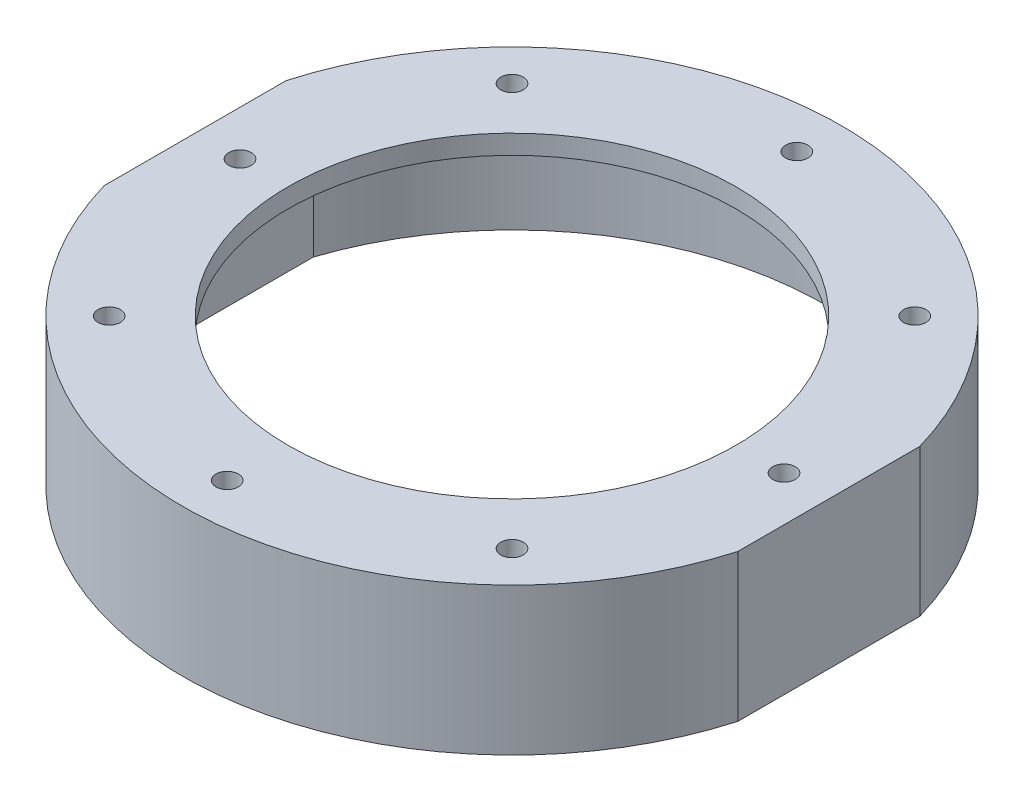
from build123d import *

# Parameters (mm, degrees)
SKETCH_1_R          = 52
EXTRUDE_1_DEPTH     = 20
CUT_EXTRUDE_START   = -20
SKETCH_2_R          = 52
SKETCH_2_R_2        = 51.5
CUT_EXTRUDE_1_DEPTH = 20
SKETCH_3_R          = 51.5
SKETCH_3_R_2        = 1.75
SKETCH_3_R_3        = 35
EXTRUDE_2_DEPTH     = 3
SKETCH_4_W          = 6.656096692
SKETCH_4_H          = 30.90307428
SKETCH_4_W_2        = 11.077487824
CUT_EXTRUDE_2_DEPTH = 77.377352664
EXTRUDE_START       = -3
SKETCH_6_R          = 1.75
SKETCH_6_R_2        = 1.891027651
EXTRUDE_3_DEPTH     = 3
SKETCH_7_R          = 1.75
CUT_EXTRUDE_3_DEPTH = 3


with BuildPart() as part:
    # 草图1 → 凸台-拉伸1 (new body)
    with BuildSketch(Plane(origin=(0, 0, 0), x_dir=(1, 0, 0), z_dir=(0, 1, 0))):
        with Locations(Location((0, 0, 0), (0, 0, 270))):
            Circle(SKETCH_1_R)
        with BuildLine():
            Line((-46.5, -15.45153714), (-46.5, 15.45153714))
            ThreePointArc((-46.5, 15.45153714), (0, 49), (46.5, 15.45153714))
            Line((46.5, 15.45153714), (46.5, -15.45153714))
            ThreePointArc((46.5, -15.45153714), (0, -49), (-46.5, -15.45153714))
        make_face(mode=Mode.SUBTRACT)
    extrude(amount=EXTRUDE_1_DEPTH)

    # 草图2 → 切除-拉伸1 (cut)
    with BuildSketch(Plane(origin=(0, 20, 0), x_dir=(1, 0, 0), z_dir=(0, 1, 0)).offset(CUT_EXTRUDE_START)):
        Circle(SKETCH_2_R)
        with Locations(Location((0, 0, 0), (0, 0, 270))):
            Circle(SKETCH_2_R_2, mode=Mode.SUBTRACT)
    extrude(amount=CUT_EXTRUDE_1_DEPTH, mode=Mode.SUBTRACT)

    # 草图3 → 凸台-拉伸2 (add)
    with BuildSketch(Plane(origin=(0, 20, 0), x_dir=(1, 0, 0), z_dir=(0, 1, 0))):
        with Locations(Location((0, 0, 0), (0, 0, 270))):
            Circle(SKETCH_3_R)
        with Locations(Location((0, 42.5, 0), (0, 0, 270))):
            Circle(SKETCH_3_R_2, mode=Mode.SUBTRACT)
        with Locations(Location((30.0520382, 30.0520382, 0), (0, 0, 270))):
            Circle(SKETCH_3_R_2, mode=Mode.SUBTRACT)
        with Locations(Location((42.5, 0, 0), (0, 0, 270))):
            Circle(SKETCH_3_R_2, mode=Mode.SUBTRACT)
        with Locations(Location((30.0520382, -30.0520382, 0), (0, 0, 270))):
            Circle(SKETCH_3_R_2, mode=Mode.SUBTRACT)
        with Locations(Location((0, -42.5, 0), (0, 0, 270))):
            Circle(SKETCH_3_R_2, mode=Mode.SUBTRACT)
        with Locations(Location((-30.0520382, -30.0520382, 0), (0, 0, 270))):
            Circle(SKETCH_3_R_2, mode=Mode.SUBTRACT)
        with Locations(Location((-42.5, 0, 0), (0, 0, 270))):
            Circle(SKETCH_3_R_2, mode=Mode.SUBTRACT)
        with Locations(Location((-30.0520382, 30.0520382, 0), (0, 0, 270))):
            Circle(SKETCH_3_R_2, mode=Mode.SUBTRACT)
        with Locations(Location((0, 0, 0), (0, 0, 270))):
            Circle(SKETCH_3_R_3, mode=Mode.SUBTRACT)
    extrude(amount=EXTRUDE_2_DEPTH)

    # 草图4 → 切除-拉伸2 (cut, through all)
    with BuildSketch(Plane.XZ):
        with Locations((-52.828048346, 0)):
            Rectangle(SKETCH_4_W, SKETCH_4_H)
        with Locations((55.038743912, 0)):
            Rectangle(SKETCH_4_W_2, SKETCH_4_H)
    extrude(amount=-CUT_EXTRUDE_2_DEPTH, mode=Mode.SUBTRACT)

    # 草图6 → 凸台-拉伸3 (add)
    with BuildSketch(Plane(origin=(0, 23, 0), x_dir=(1, 0, 0), z_dir=(0, 1, 0)).offset(EXTRUDE_START)):
        with Locations((-30.0520382, 30.0520382)):
            Circle(SKETCH_6_R)
        with Locations((0, 42.5)):
            Circle(SKETCH_6_R)
        with Locations((30.0520382, 30.0520382)):
            Circle(SKETCH_6_R)
        with Locations((30.0520382, -30.0520382)):
            Circle(SKETCH_6_R_2)
        with Locations((0, -42.5)):
            Circle(SKETCH_6_R)
        with Locations((-30.0520382, -30.0520382)):
            Circle(SKETCH_6_R)
    extrude(amount=EXTRUDE_3_DEPTH)

    # 草图7 → 切除-拉伸3 (cut)
    with BuildSketch(Plane(origin=(0, 23, 0), x_dir=(1, 0, 0), z_dir=(0, 1, 0))):
        with Locations(Location((0, 44.5, 0), (0, 0, 270))):
            Circle(SKETCH_7_R)
        with Locations(Location((31.466251763, 31.466251763, 0), (0, 0, 270))):
            Circle(SKETCH_7_R)
        with Locations(Location((31.466251763, -31.466251763, 0), (0, 0, 270))):
            Circle(SKETCH_7_R)
        with Locations(Location((0, -44.5, 0), (0, 0, 270))):
            Circle(SKETCH_7_R)
        with Locations(Location((-31.466251763, -31.466251763, 0), (0, 0, 270))):
            Circle(SKETCH_7_R)
        with Locations(Location((-31.466251763, 31.466251763, 0), (0, 0, 270))):
            Circle(SKETCH_7_R)
    extrude(amount=-CUT_EXTRUDE_3_DEPTH, mode=Mode.SUBTRACT)


solid = part.part
